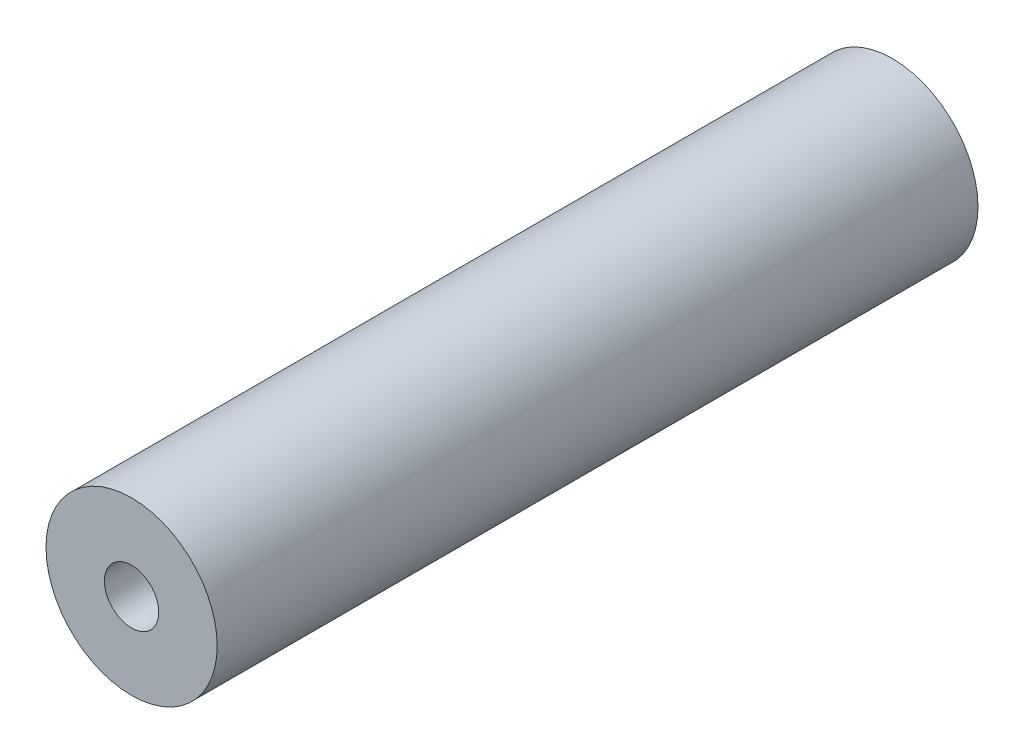
from build123d import *

# Parameters (mm, degrees)
SKETCH_1_R      = 3.15
SKETCH_1_R_2    = 1
EXTRUDE_1_DEPTH = 28


with BuildPart() as part:
    # Эскиз1 → Бобышка-Вытянуть1 (new body)
    with BuildSketch(Plane.XY):
        Circle(SKETCH_1_R)
        Circle(SKETCH_1_R_2, mode=Mode.SUBTRACT)
    extrude(amount=EXTRUDE_1_DEPTH)


solid = part.part
